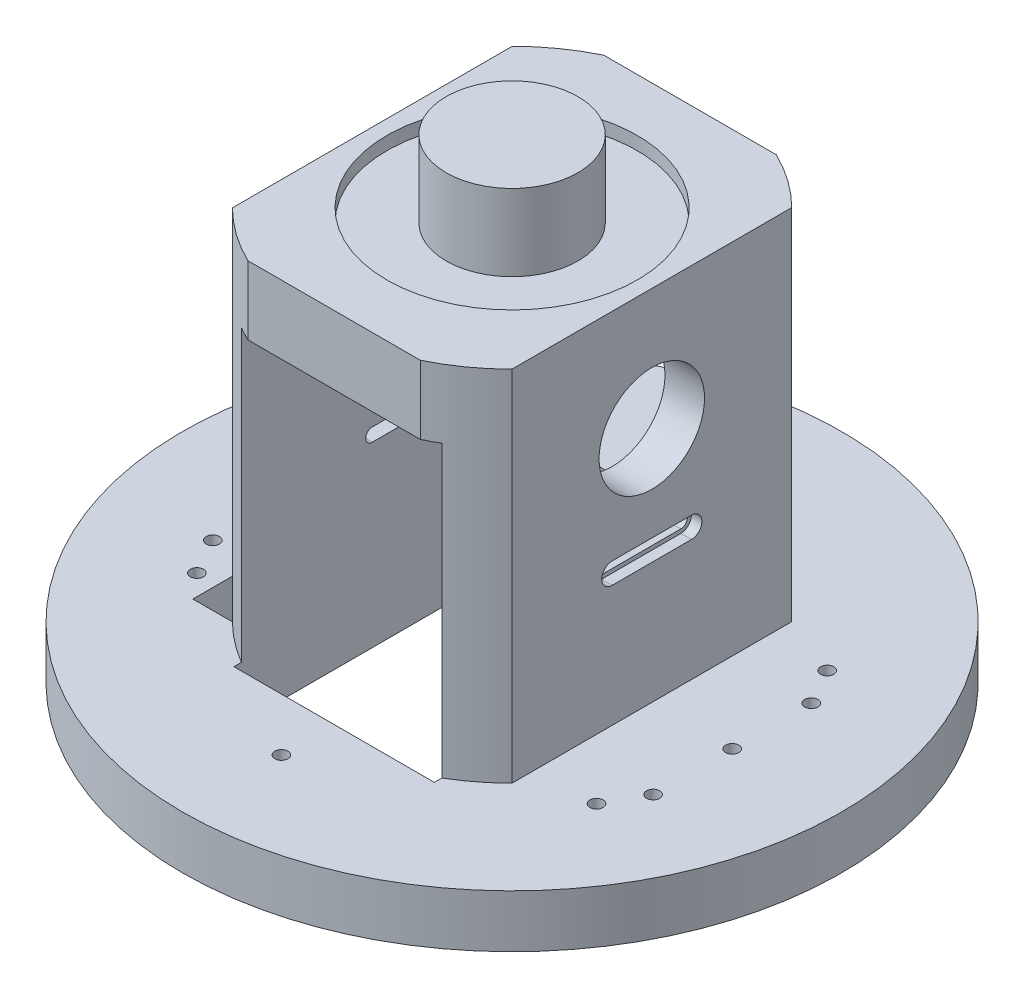
from build123d import *

# Parameters (mm, degrees)
SKETCH1_R                = 125
BOSS_EXTRUDE1_DEPTH      = 20
SKETCH2_W                = 106
SKETCH2_H                = 135
BOSS_EXTRUDE2_DEPTH      = 160
SKETCH5_R                = 20
CUT_EXTRUDE2_DEPTH       = 283.327823638
SKETCH6_W                = 76
SKETCH6_H                = 135
CUT_EXTRUDE3_DEPTH       = 130
SKETCH7_W                = 106
SKETCH7_H                = 135
SKETCH7_R                = 25
CUT_EXTRUDE5_DEPTH       = 29
SKETCH10_W               = 106
SKETCH10_H               = 135
SKETCH10_R               = 47.5
BOSS_EXTRUDE4_DEPTH      = 5
SKETCH11_R               = 2.5
CUT_EXTRUDE6_DEPTH       = 253.289516231
SKETCH12_R               = 2.5
CUT_EXTRUDE7_DEPTH       = 253.289516231
SKETCH13_R               = 5
CUT_EXTRUDE8_DEPTH       = 5
CUT_EXTRUDE10_REACH      = 237.767
SKETCH14_R               = 94.455144731
SKETCH14_R_2             = 75
SKETCH15_W               = 15
SKETCH15_H               = 106.131993292
CUT_EXTRUDE11_DEPTH      = 20
CUT_EXTRUDE12_DEPTH      = 274.119021674
CUT_EXTRUDE12_DEPTH_BACK = 274.119021674
CUT_EXTRUDE13_DEPTH      = 4


with BuildPart() as part:
    # Sketch1 → Boss-Extrude1 (new body)
    with BuildSketch(Plane(origin=(0, 0, 0), x_dir=(1, 0, 0), z_dir=(0, 1, 0))):
        with Locations(Location((0, 0, 0), (0, 0, 270))):
            Circle(SKETCH1_R)
    extrude(amount=BOSS_EXTRUDE1_DEPTH)

    # Sketch2 → Boss-Extrude2 (add)
    with BuildSketch(Plane(origin=(0, 20, 0), x_dir=(1, 0, 0), z_dir=(0, 1, 0))):
        Rectangle(SKETCH2_W, SKETCH2_H)
    extrude(amount=BOSS_EXTRUDE2_DEPTH)

    # Sketch5 → Cut-Extrude2 (cut, through all)
    with BuildSketch(Plane(origin=(53, 0, 0), x_dir=(0, 0, -1), z_dir=(1, 0, 0))):
        with Locations((0, 110)):
            Circle(SKETCH5_R)
    extrude(amount=-CUT_EXTRUDE2_DEPTH, mode=Mode.SUBTRACT)

    # Sketch6 → Cut-Extrude3 (cut)
    with BuildSketch(Plane.XZ):
        Rectangle(SKETCH6_W, SKETCH6_H)
    extrude(amount=-CUT_EXTRUDE3_DEPTH, mode=Mode.SUBTRACT)

    # Sketch7 → Cut-Extrude5 (cut)
    with BuildSketch(Plane(origin=(0, 180, 0), x_dir=(1, 0, 0), z_dir=(0, 1, 0))):
        Rectangle(SKETCH7_W, SKETCH7_H)
        with Locations(Location((0, 0, 0), (0, 0, 270))):
            Circle(SKETCH7_R, mode=Mode.SUBTRACT)
    extrude(amount=-CUT_EXTRUDE5_DEPTH, mode=Mode.SUBTRACT)

    # Sketch10 → Boss-Extrude4 (add)
    with BuildSketch(Plane(origin=(0, 151, 0), x_dir=(1, 0, 0), z_dir=(0, 1, 0))):
        Rectangle(SKETCH10_W, SKETCH10_H)
        with Locations(Location((0, 0, 0), (0, 0, 270))):
            Circle(SKETCH10_R, mode=Mode.SUBTRACT)
    extrude(amount=BOSS_EXTRUDE4_DEPTH)

    # Sketch11 → Cut-Extrude6 (cut, through all)
    with BuildSketch(Plane(origin=(0, 0, 0), x_dir=(-1, 0, 0), z_dir=(0, -1, 0))):
        with Locations(Location((83.502937015, 0, 0), (0, 0, 90))):
            Circle(SKETCH11_R)
        with Locations(Location((-83.502937015, 0, 0), (0, 0, 90))):
            Circle(SKETCH11_R)
        with Locations(Location((83.502937015, -30, 0), (0, 0, 90))):
            Circle(SKETCH11_R)
        with Locations(Location((83.502937015, 30, 0), (0, 0, 90))):
            Circle(SKETCH11_R)
        with Locations(Location((-83.502937015, 30, 0), (0, 0, 90))):
            Circle(SKETCH11_R)
        with Locations(Location((-83.502937015, -30, 0), (0, 0, 90))):
            Circle(SKETCH11_R)
    extrude(amount=-CUT_EXTRUDE6_DEPTH, mode=Mode.SUBTRACT)

    # Sketch12 → Cut-Extrude7 (cut, through all)
    with BuildSketch(Plane(origin=(0, 0, 0), x_dir=(-1, 0, 0), z_dir=(0, -1, 0))):
        with Locations(Location((0, 87.5, 0), (0, 0, 90))):
            Circle(SKETCH12_R)
        with Locations(Location((75.777222831, 43.75, 0), (0, 0, 90))):
            Circle(SKETCH12_R)
        with Locations(Location((75.777222831, -43.75, 0), (0, 0, 90))):
            Circle(SKETCH12_R)
        with Locations(Location((0, -87.5, 0), (0, 0, 90))):
            Circle(SKETCH12_R)
        with Locations(Location((-75.777222831, -43.75, 0), (0, 0, 90))):
            Circle(SKETCH12_R)
        with Locations(Location((-75.777222831, 43.75, 0), (0, 0, 90))):
            Circle(SKETCH12_R)
    extrude(amount=-CUT_EXTRUDE7_DEPTH, mode=Mode.SUBTRACT)

    # Sketch13 → Cut-Extrude8 (cut)
    with BuildSketch(Plane(origin=(0, 0, 0), x_dir=(-1, 0, 0), z_dir=(0, -1, 0))):
        with Locations(Location((0, -87.5, 0), (0, 0, 90))):
            Circle(SKETCH13_R)
        with Locations(Location((-75.777222831, -43.75, 0), (0, 0, 90))):
            Circle(SKETCH13_R)
        with Locations(Location((-75.777222831, 43.75, 0), (0, 0, 90))):
            Circle(SKETCH13_R)
        with Locations(Location((0, 87.5, 0), (0, 0, 90))):
            Circle(SKETCH13_R)
        with Locations(Location((75.777222831, 43.75, 0), (0, 0, 90))):
            Circle(SKETCH13_R)
        with Locations(Location((75.777222831, -43.75, 0), (0, 0, 90))):
            Circle(SKETCH13_R)
    extrude(amount=-CUT_EXTRUDE8_DEPTH, mode=Mode.SUBTRACT)

    # Cut-Extrude10: up to this face of the body (flat: up to its plane)
    cut_extrude10_end = Plane(part.part.faces().sort_by_distance((0, 20, -121.464466094))[0])
    # Sketch14 → Cut-Extrude10 (cut, up to the picked face)
    with BuildSketch(Plane(origin=(0, 156, 0), x_dir=(1, 0, 0), z_dir=(0, 1, 0)), mode=Mode.PRIVATE) as cut_extrude10_sk1:
        Circle(SKETCH14_R)
        Circle(SKETCH14_R_2, mode=Mode.SUBTRACT)
    cut_extrude10_tool1 = split(extrude(cut_extrude10_sk1.sketch, amount=-CUT_EXTRUDE10_REACH, mode=Mode.PRIVATE), bisect_by=cut_extrude10_end, keep=Keep.BOTH, mode=Mode.PRIVATE)
    add(cut_extrude10_tool1.solids().sort_by(Axis((-91.78355, 156, 0), (0, -1, 0)))[0], mode=Mode.SUBTRACT)

    # Sketch15 → Cut-Extrude11 (cut)
    with BuildSketch(Plane(origin=(0, 20, 0), x_dir=(1, 0, 0), z_dir=(0, 1, 0))):
        with Locations((-60.5, 0)):
            Rectangle(SKETCH15_W, SKETCH15_H)
    extrude(amount=-CUT_EXTRUDE11_DEPTH, mode=Mode.SUBTRACT)

    # Sketch16 → Cut-Extrude12 (cut, two sides: drawn at the far end of the back side and taken through both)
    with BuildSketch(Plane(origin=(-38, 0, 0), x_dir=(0, 0, -1), z_dir=(1, 0, 0)).offset(-CUT_EXTRUDE12_DEPTH_BACK)):
        with BuildLine():
            Line((-15, 72.5), (15, 72.5))
            ThreePointArc((15, 72.5), (17.5, 70), (15, 67.5))
            Line((15, 67.5), (-15, 67.5))
            ThreePointArc((-15, 67.5), (-17.5, 70), (-15, 72.5))
        make_face()
    extrude(amount=CUT_EXTRUDE12_DEPTH + CUT_EXTRUDE12_DEPTH_BACK, mode=Mode.SUBTRACT)

    # Sketch17 → Cut-Extrude13 (cut)
    with BuildSketch(Plane.ZY.offset(53)):
        with BuildLine():
            Line((-15, 74), (15, 74))
            ThreePointArc((15, 74), (19, 70), (15, 66))
            Line((15, 66), (-15, 66))
            ThreePointArc((-15, 66), (-19, 70), (-15, 74))
        make_face()
    cut_extrude13 = extrude(amount=-CUT_EXTRUDE13_DEPTH, mode=Mode.SUBTRACT)

    # Mirror1: Cut-Extrude13 across plane
    add(cut_extrude13.mirror(Plane(origin=(0, 0, 0), x_dir=(0, 0, 1), z_dir=(1, 0, 0))), mode=Mode.SUBTRACT)


solid = part.part
